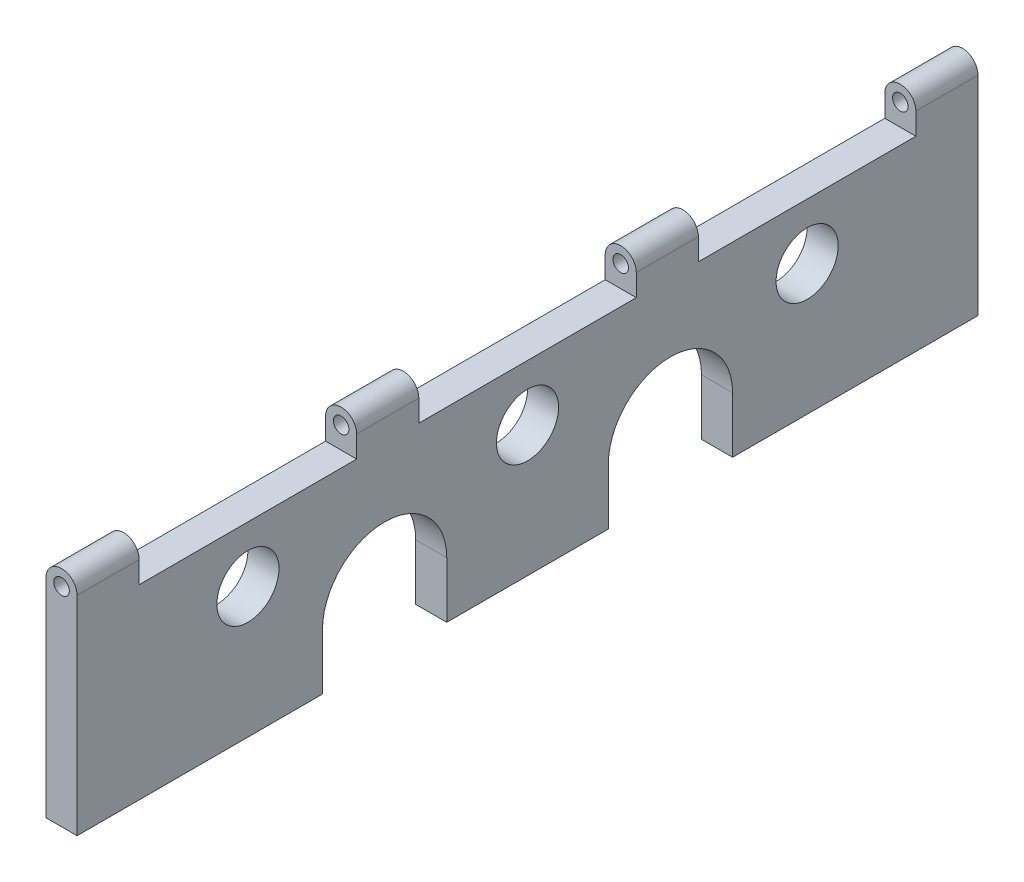
from build123d import *

# Parameters (mm, degrees)
SKETCH_1_R          = 5
EXTRUDE_1_DEPTH     = 5
SKETCH_2_W          = 10
SKETCH_2_H          = 6
EXTRUDE_2_DEPTH     = 5
SKETCH_3_R          = 1.25
CUT_EXTRUDE_2_DEPTH = 150.485785277


with BuildPart() as part:
    # Эскиз1 → Бобышка-Вытянуть1 (new body)
    with BuildSketch(Plane(origin=(0, 0, 0), x_dir=(0, 0, -1), z_dir=(1, 0, 0))):
        with BuildLine():
            Line((0, 0), (39.5, 0))
            Line((39.5, 0), (39.5, 9))
            ThreePointArc((39.5, 9), (49.5, 19), (59.5, 9))
            Line((59.5, 9), (59.5, 0))
            Line((59.5, 0), (85.5, 0))
            Line((85.5, 0), (85.5, 9))
            ThreePointArc((85.5, 9), (95.5, 19), (105.5, 9))
            Line((105.5, 9), (105.5, 0))
            Line((105.5, 0), (145, 0))
            Line((145, 0), (145, 30))
            Line((145, 30), (0, 30))
            Line((0, 30), (0, 0))
        make_face()
        with Locations((27.5, 21)):
            Circle(SKETCH_1_R, mode=Mode.SUBTRACT)
        with Locations((72.5, 21)):
            Circle(SKETCH_1_R, mode=Mode.SUBTRACT)
        with Locations((117.5, 21)):
            Circle(SKETCH_1_R, mode=Mode.SUBTRACT)
    extrude(amount=EXTRUDE_1_DEPTH)

    # Эскиз2 → Бобышка-Вытянуть2 (add)
    with BuildSketch(Plane(origin=(5, 0, 0), x_dir=(0, 0, -1), z_dir=(1, 0, 0))):
        with Locations((5, 33)):
            Rectangle(SKETCH_2_W, SKETCH_2_H)
        with Locations((50, 33)):
            Rectangle(SKETCH_2_W, SKETCH_2_H)
        with Locations((95, 33)):
            Rectangle(SKETCH_2_W, SKETCH_2_H)
        with Locations((140, 33)):
            Rectangle(SKETCH_2_W, SKETCH_2_H)
    extrude(amount=-EXTRUDE_2_DEPTH)

    # Эскиз3 → Вырез-Вытянуть2 (cut, through all)
    with BuildSketch(Plane.XY):
        with BuildLine():
            Line((0, 36), (0, 33.5))
            ThreePointArc((0, 33.5), (0.732233047, 35.267766953), (2.5, 36))
            Line((2.5, 36), (0, 36))
        make_face()
        with BuildLine():
            ThreePointArc((2.5, 36), (4.267766953, 35.267766953), (5, 33.5))
            Line((5, 33.5), (5, 36))
            Line((5, 36), (2.5, 36))
        make_face()
        with Locations((2.5, 33.5)):
            Circle(SKETCH_3_R)
    extrude(amount=-CUT_EXTRUDE_2_DEPTH, mode=Mode.SUBTRACT)


solid = part.part
